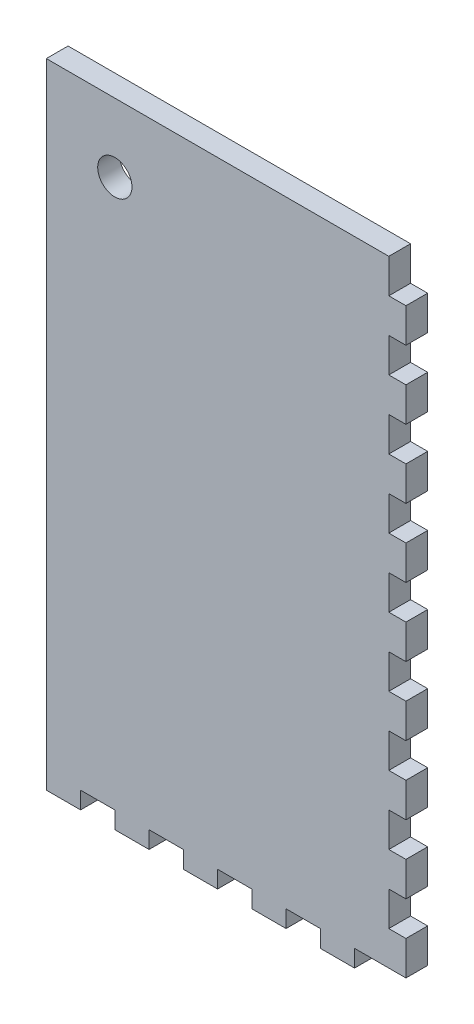
from build123d import *

# Parameters (mm, degrees)
SKETCH1_W           = 50
SKETCH1_H           = 90
BOSS_EXTRUDE2_DEPTH = 3.175
SKETCH2_W           = 3.175
SKETCH2_H           = 5
BOSS_EXTRUDE3_DEPTH = 2.5
LPATTERN1_COUNT     = 9
LPATTERN1_PITCH     = 10
SKETCH3_W           = 5
SKETCH3_H           = 3.175
BOSS_EXTRUDE4_DEPTH = 2.5
LPATTERN2_COUNT     = 5
LPATTERN2_PITCH     = 10
SKETCH4_R           = 2.5
CUT_EXTRUDE1_DEPTH  = 10


with BuildPart() as part:
    # Sketch1 → Boss-Extrude2 (new body)
    with BuildSketch(Plane.XY):
        with Locations((25, 45)):
            Rectangle(SKETCH1_W, SKETCH1_H)
    extrude(amount=BOSS_EXTRUDE2_DEPTH)

    # Sketch2 → Boss-Extrude3 (add)
    with BuildSketch(Plane(origin=(50, 0, 0), x_dir=(0, 0, -1), z_dir=(1, 0, 0))):
        with Locations((-1.5875, 2.5)):
            Rectangle(SKETCH2_W, SKETCH2_H)
    boss_extrude3 = extrude(amount=BOSS_EXTRUDE3_DEPTH)

    # LPattern1: Boss-Extrude3 ×9
    with Locations(*[(0, i * LPATTERN1_PITCH, 0) for i in range(1, LPATTERN1_COUNT)]):
        add(boss_extrude3)

    # Sketch3 → Boss-Extrude4 (add)
    with BuildSketch(Plane.XZ):
        with Locations((2.5, 1.5875)):
            Rectangle(SKETCH3_W, SKETCH3_H)
    boss_extrude4 = extrude(amount=BOSS_EXTRUDE4_DEPTH)

    # LPattern2: Boss-Extrude4 ×5
    with Locations(*[(i * LPATTERN2_PITCH, 0, 0) for i in range(1, LPATTERN2_COUNT)]):
        add(boss_extrude4)

    # Sketch4 → Cut-Extrude1 (cut)
    with BuildSketch(Plane.XY.offset(3.175)):
        with Locations((10, 80)):
            Circle(SKETCH4_R)
    extrude(amount=-CUT_EXTRUDE1_DEPTH, mode=Mode.SUBTRACT)


solid = part.part
